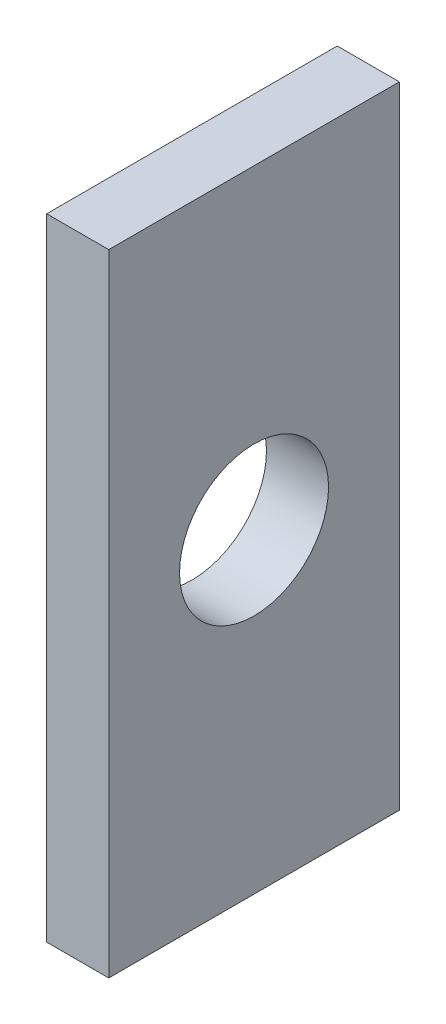
from build123d import *

# Parameters (mm, degrees)
SKETCH1_W           = 11.7
SKETCH1_H           = 25.4
SKETCH1_R           = 3
BOSS_EXTRUDE1_DEPTH = 2.5


with BuildPart() as part:
    # Sketch1 → Boss-Extrude1 (new body)
    with BuildSketch(Plane(origin=(0, 0, 0), x_dir=(0, 0, -1), z_dir=(1, 0, 0))):
        with Locations((-266.932453234, -25.29608512)):
            Rectangle(SKETCH1_W, SKETCH1_H)
        with Locations((-266.932453234, -25.29608512)):
            Circle(SKETCH1_R, mode=Mode.SUBTRACT)
    extrude(amount=BOSS_EXTRUDE1_DEPTH)


solid = part.part
